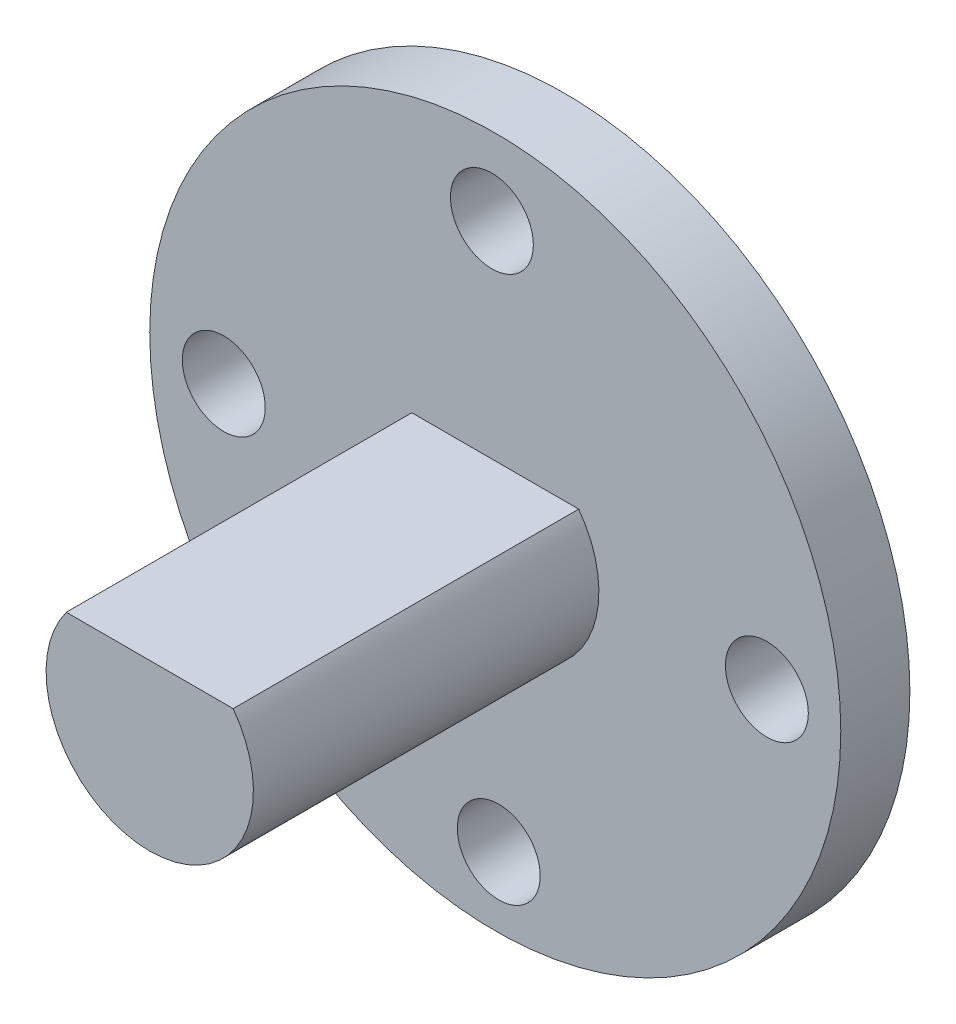
from build123d import *

# Parameters (mm, degrees)
ESQUISSE1_R                  = 10
BOSS_EXTRU_1_DEPTH           = 2
D_GAGEMENT_M21_D             = 2.4
R_P_TITION_CIRCULAIRE1_COUNT = 4
ESQUISSE4_R                  = 3
BOSS_EXTRU_2_DEPTH           = 10
ESQUISSE5_W                  = 6
ESQUISSE5_H                  = 1.22
ENL_V_MAT_EXTRU_1_DEPTH      = 10


with BuildPart() as part:
    # Esquisse1 → Boss.-Extru.1 (new body)
    with BuildSketch(Plane.XY):
        Circle(ESQUISSE1_R)
    extrude(amount=BOSS_EXTRU_1_DEPTH)

    # Dégagement M21 (through all)
    with Locations(Plane(origin=(-0.098042357, 7.745346196, 2), x_dir=(1, 0, 0), z_dir=(0, 0, 1))):
        with Locations((0, 0)):
            d_gagement_m21 = Hole(D_GAGEMENT_M21_D / 2)

    # Répétition circulaire1: Dégagement M21 ×4 about axis
    r_p_tition_circulaire1_axis = Axis((0.001432437, -0.113162526, 0), (0, 0, 1))
    for i in range(1, R_P_TITION_CIRCULAIRE1_COUNT):
        add(d_gagement_m21.rotate(r_p_tition_circulaire1_axis, i * 360 / R_P_TITION_CIRCULAIRE1_COUNT), mode=Mode.SUBTRACT)

    # Esquisse4 → Boss.-Extru.2 (add)
    with BuildSketch(Plane.XY.offset(2)):
        Circle(ESQUISSE4_R)
    extrude(amount=BOSS_EXTRU_2_DEPTH)

    # Esquisse5 → Enlèv. mat.-Extru.1 (cut)
    with BuildSketch(Plane.XY.offset(12)):
        with Locations((0, 2.39)):
            Rectangle(ESQUISSE5_W, ESQUISSE5_H)
    extrude(amount=-ENL_V_MAT_EXTRU_1_DEPTH, mode=Mode.SUBTRACT)


solid = part.part
